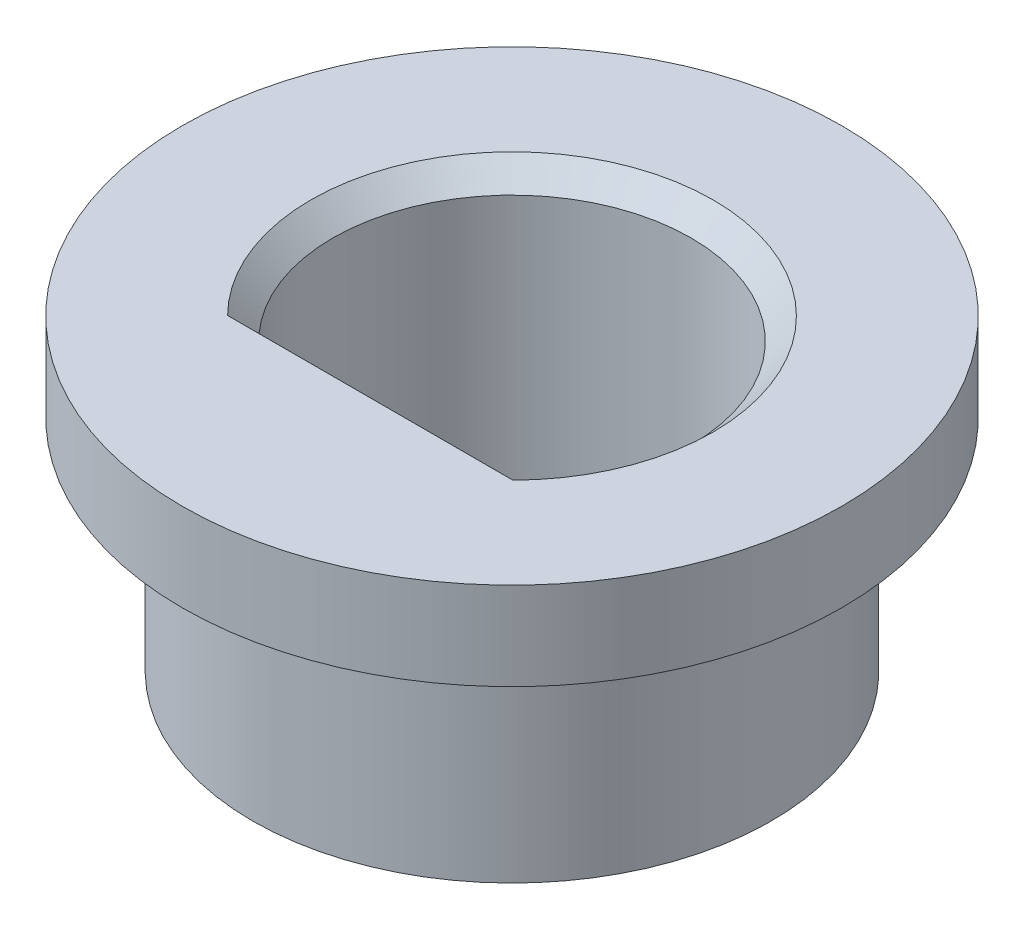
from build123d import *

# Parameters (mm, degrees)
SCHNITT_LINEAR_AUSTRAGEN1_DEPTH = 13.708265027
FASE1_SIZE                      = 0.5


with BuildPart() as part:
    # Skizze1 → Rotation1 (revolve)
    with BuildSketch(Plane.XY, mode=Mode.PRIVATE) as rotation1_sk:
        Polygon((0, 0), (5.9, 0), (5.9, 5), (7.5, 5), (7.5, 7), (0, 7), align=None)
    revolve(rotation1_sk.sketch.rotate(Axis((0, 0, 0), (0, -1, 0)), 90), axis=Axis((0, 0, 0), (0, -1, 0)))

    # Skizze2 → Schnitt-Linear austragen1 (cut, through all)
    with BuildSketch(Plane(origin=(0, 7, 0), x_dir=(1, 0, 0), z_dir=(0, 1, 0))):
        with BuildLine():
            Line((-3.029851482, -2.725), (3.029851482, -2.725))
            ThreePointArc((3.029851482, -2.725), (0, 4.075), (-3.029851482, -2.725))
        make_face()
    extrude(amount=-SCHNITT_LINEAR_AUSTRAGEN1_DEPTH, mode=Mode.SUBTRACT)

    # Fase1
    fase1_edges = [part.edges().sort_by_distance(p)[0] for p in [
        (0, 7, -4.075),
        (0, 7, 2.725),
    ]]
    chamfer(fase1_edges, length=FASE1_SIZE)


solid = part.part
